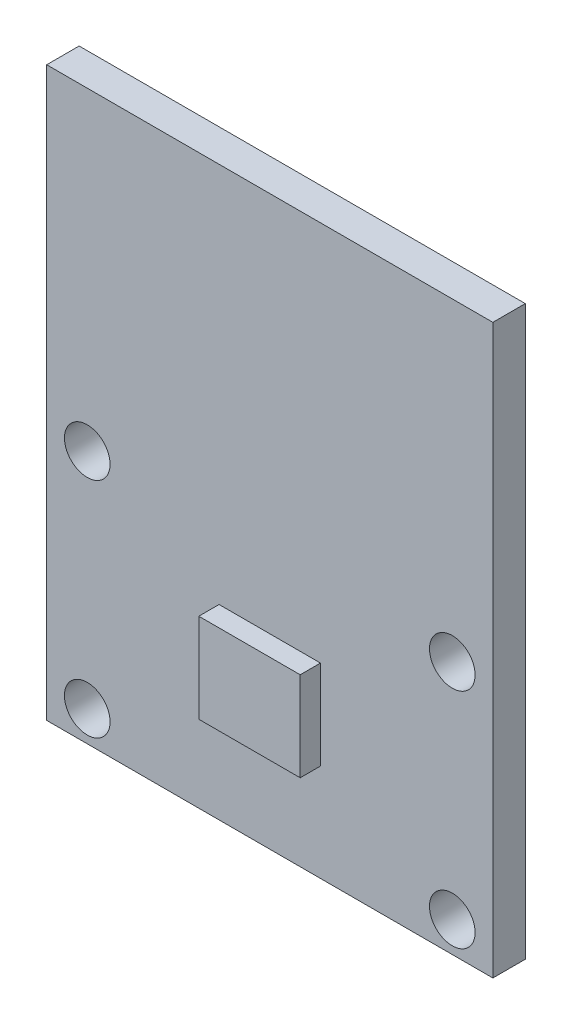
from build123d import *

# Parameters (mm, degrees)
SKETCH1_W           = 22
SKETCH1_H           = 28
BOSS_EXTRUDE1_DEPTH = 1.6
SKETCH3_R           = 1.125
CUT_EXTRUDE1_DEPTH  = 36.644915486
SKETCH4_W           = 5
SKETCH4_H           = 4.4
BOSS_EXTRUDE2_DEPTH = 1


with BuildPart() as part:
    # Sketch1 → Boss-Extrude1 (new body)
    with BuildSketch(Plane.XY):
        with Locations((11, 14)):
            Rectangle(SKETCH1_W, SKETCH1_H)
    extrude(amount=BOSS_EXTRUDE1_DEPTH)

    # Sketch3 → Cut-Extrude1 (cut, through all)
    with BuildSketch(Plane.XY.offset(1.6)):
        with Locations((2, 1.5)):
            Circle(SKETCH3_R)
        with Locations((2, 12.5)):
            Circle(SKETCH3_R)
        with Locations((20, 1.5)):
            Circle(SKETCH3_R)
        with Locations((20, 12.5)):
            Circle(SKETCH3_R)
    extrude(amount=-CUT_EXTRUDE1_DEPTH, mode=Mode.SUBTRACT)

    # Sketch4 → Boss-Extrude2 (add)
    with BuildSketch(Plane.XY.offset(1.6)):
        with Locations((11, 7)):
            Rectangle(SKETCH4_W, SKETCH4_H)
    extrude(amount=BOSS_EXTRUDE2_DEPTH)


solid = part.part
